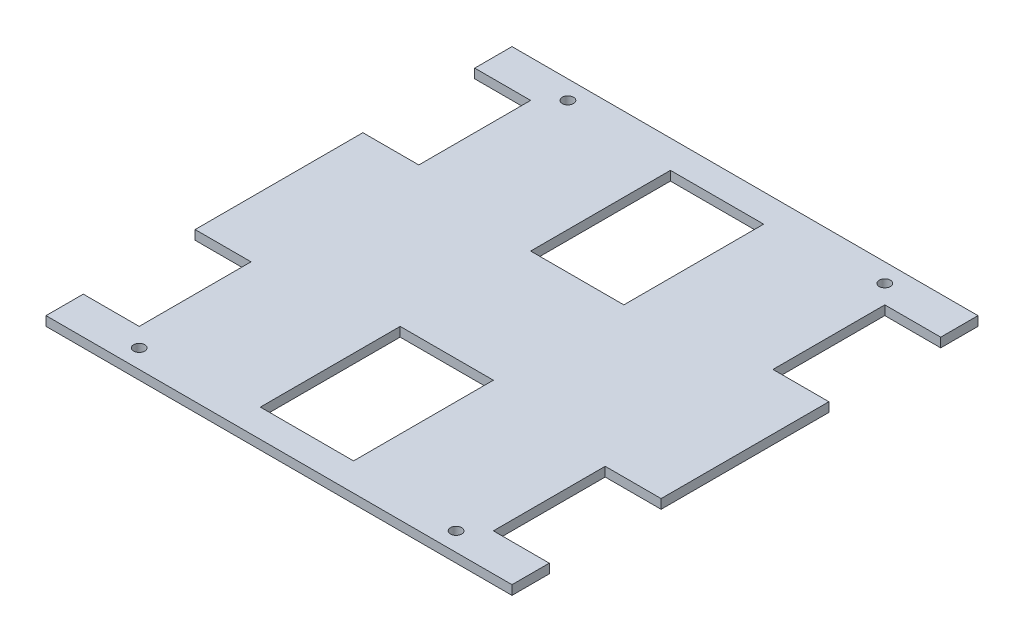
from build123d import *

# Parameters (mm, degrees)
SKETCH2_W           = 50
SKETCH2_H           = 75
SKETCH2_R           = 3
BOSS_EXTRUDE1_DEPTH = 5


with BuildPart() as part:
    # Sketch2 → Boss-Extrude1 (new body)
    with BuildSketch(Plane(origin=(0, 0, 0), x_dir=(1, 0, 0), z_dir=(0, 1, 0))):
        Polygon((-125, 125), (-125, 105), (-95, 105), (-95, 45), (-125, 45), (-125, -45), (-95, -45), (-95, -105), (-125, -105), (-125, -125), (125, -125), (125, -105), (95, -105), (95, -45), (125, -45), (125, 45), (95, 45), (95, 105), (125, 105), (125, 125), align=None)
        with Locations((0, -72.5)):
            Rectangle(SKETCH2_W, SKETCH2_H, mode=Mode.SUBTRACT)
        with Locations((0, 72.5)):
            Rectangle(SKETCH2_W, SKETCH2_H, mode=Mode.SUBTRACT)
        with Locations(Location((-85, 115, 0), (0, 0, 270))):
            Circle(SKETCH2_R, mode=Mode.SUBTRACT)
        with Locations(Location((-85, -115, 0), (0, 0, 270))):
            Circle(SKETCH2_R, mode=Mode.SUBTRACT)
        with Locations(Location((85, 115, 0), (0, 0, 270))):
            Circle(SKETCH2_R, mode=Mode.SUBTRACT)
        with Locations(Location((85, -115, 0), (0, 0, 270))):
            Circle(SKETCH2_R, mode=Mode.SUBTRACT)
    extrude(amount=BOSS_EXTRUDE1_DEPTH)


solid = part.part
